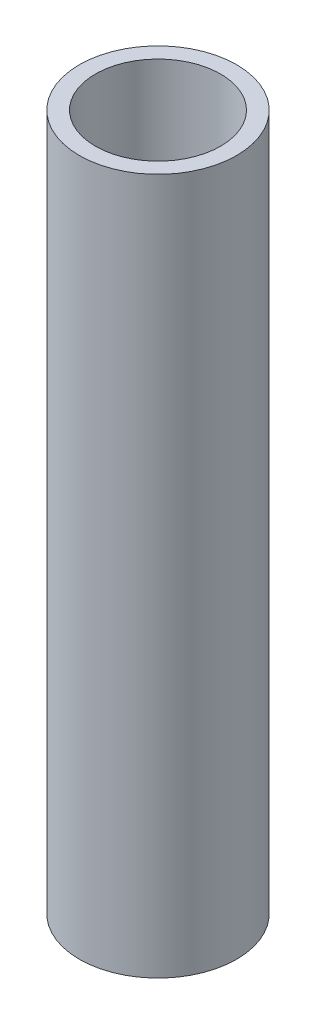
from build123d import *

# Parameters (mm, degrees)
SKETCH1_R           = 11.811
BOSS_EXTRUDE1_DEPTH = 104.521
SKETCH2_R           = 9.398
CUT_EXTRUDE1_DEPTH  = 99.441
SKETCH3_R           = 6.096
CUT_EXTRUDE2_DEPTH  = 106.847243153


with BuildPart() as part:
    # Sketch1 → Boss-Extrude1 (new body)
    with BuildSketch(Plane(origin=(0, 0, 0), x_dir=(1, 0, 0), z_dir=(0, 1, 0))):
        with Locations(Location((0, 0, 0), (0, 0, 270))):
            Circle(SKETCH1_R)
    extrude(amount=-BOSS_EXTRUDE1_DEPTH)

    # Sketch2 → Cut-Extrude1 (cut)
    with BuildSketch(Plane(origin=(0, 0, 0), x_dir=(1, 0, 0), z_dir=(0, 1, 0))):
        with Locations(Location((0, 0, 0), (0, 0, 270))):
            Circle(SKETCH2_R)
    extrude(amount=-CUT_EXTRUDE1_DEPTH, mode=Mode.SUBTRACT)

    # Sketch3 → Cut-Extrude2 (cut, through all)
    with BuildSketch(Plane(origin=(0, 0, 0), x_dir=(1, 0, 0), z_dir=(0, 1, 0))):
        with Locations(Location((0, 0, 0), (0, 0, 270))):
            Circle(SKETCH3_R)
    extrude(amount=-CUT_EXTRUDE2_DEPTH, mode=Mode.SUBTRACT)


solid = part.part
